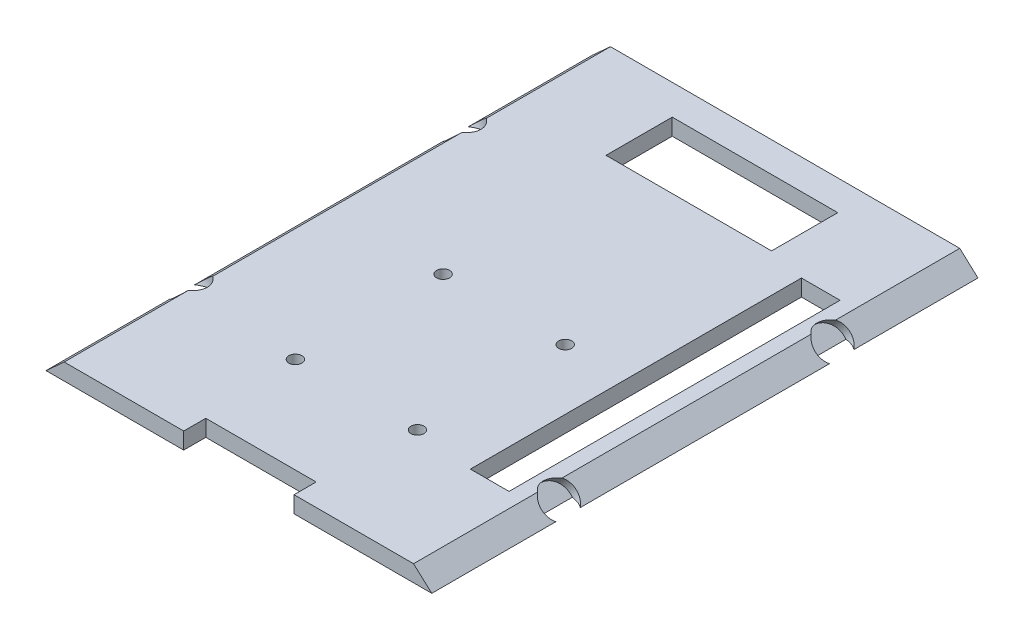
from build123d import *

# Parameters (mm, degrees)
BOSS_EXTRUDE1_DEPTH = 125.73
SKETCH3_W           = 25.4
SKETCH3_H           = 5.08
CUT_EXTRUDE1_DEPTH  = 134.393493158
SKETCH5_W           = 8.89
SKETCH5_H           = 76.2
CUT_EXTRUDE3_DEPTH  = 134.393493158
SKETCH6_W           = 38.1
SKETCH6_H           = 15.24
CUT_EXTRUDE4_DEPTH  = 134.393493158
SKETCH7_R           = 4.0005
CUT_EXTRUDE5_DEPTH  = 2
SKETCH8_R           = 4.0005
CUT_EXTRUDE6_DEPTH  = 2
SKETCH9_R           = 1.5
CUT_EXTRUDE8_DEPTH  = 134.393493158


with BuildPart() as part:
    # Sketch1 → Boss-Extrude1 (new body)
    with BuildSketch(Plane.XY):
        Polygon((-40.203883769, 5.937788296), (40.203883769, 5.937788296), (44.399042974, 2.127788296), (-44.399042974, 2.127788296), align=None)
    extrude(amount=BOSS_EXTRUDE1_DEPTH)

    # Sketch3 → Cut-Extrude1 (cut, through all)
    with BuildSketch(Plane.XZ.offset(-2.127788296)):
        with Locations((0, 123.19)):
            Rectangle(SKETCH3_W, SKETCH3_H)
    extrude(amount=-CUT_EXTRUDE1_DEPTH, mode=Mode.SUBTRACT)

    # Sketch5 → Cut-Extrude3 (cut, through all)
    with BuildSketch(Plane.XZ.offset(-2.127788296)):
        with Locations((32.334042974, 62.23)):
            Rectangle(SKETCH5_W, SKETCH5_H)
    extrude(amount=-CUT_EXTRUDE3_DEPTH, mode=Mode.SUBTRACT)

    # Sketch6 → Cut-Extrude4 (cut, through all)
    with BuildSketch(Plane.XZ.offset(-2.127788296)):
        with Locations((0, 14.553010533)):
            Rectangle(SKETCH6_W, SKETCH6_H)
    extrude(amount=-CUT_EXTRUDE4_DEPTH, mode=Mode.SUBTRACT)

    # Sketch7 → Cut-Extrude5 (cut)
    with BuildSketch(Plane(origin=(21.127225221, 23.263011377, 0), x_dir=(0.7402720771062569, -0.6723074087475075, 0), z_dir=(0.6723074087475075, 0.7402720771062569, 0))):
        with Locations((28.603318705, -94.361)):
            Circle(SKETCH7_R)
        with Locations((28.603318705, -31.369)):
            Circle(SKETCH7_R)
    extrude(amount=-CUT_EXTRUDE5_DEPTH, mode=Mode.SUBTRACT)

    # Sketch8 → Cut-Extrude6 (cut)
    with BuildSketch(Plane(origin=(-21.127225221, 23.263011377, 0), x_dir=(0.7402720771062569, 0.6723074087475075, 0), z_dir=(-0.6723074087475075, 0.7402720771062569, 0))):
        with Locations((-28.603318705, -31.369)):
            Circle(SKETCH8_R)
        with Locations((-28.603318705, -94.361)):
            Circle(SKETCH8_R)
    extrude(amount=-CUT_EXTRUDE6_DEPTH, mode=Mode.SUBTRACT)

    # Sketch9 → Cut-Extrude8 (cut, through all)
    with BuildSketch(Plane(origin=(0, 5.937788296, 0), x_dir=(1, 0, 0), z_dir=(0, 1, 0))):
        with Locations(Location((13.978116231, -98.601597848, 0), (0, 0, 270))):
            Circle(SKETCH9_R)
        with Locations(Location((-14.121883769, -98.601597848, 0), (0, 0, 270))):
            Circle(SKETCH9_R)
        with Locations(Location((-14.121883769, -64.601597848, 0), (0, 0, 270))):
            Circle(SKETCH9_R)
        with Locations(Location((13.978116231, -64.601597848, 0), (0, 0, 270))):
            Circle(SKETCH9_R)
    extrude(amount=-CUT_EXTRUDE8_DEPTH, mode=Mode.SUBTRACT)


solid = part.part
